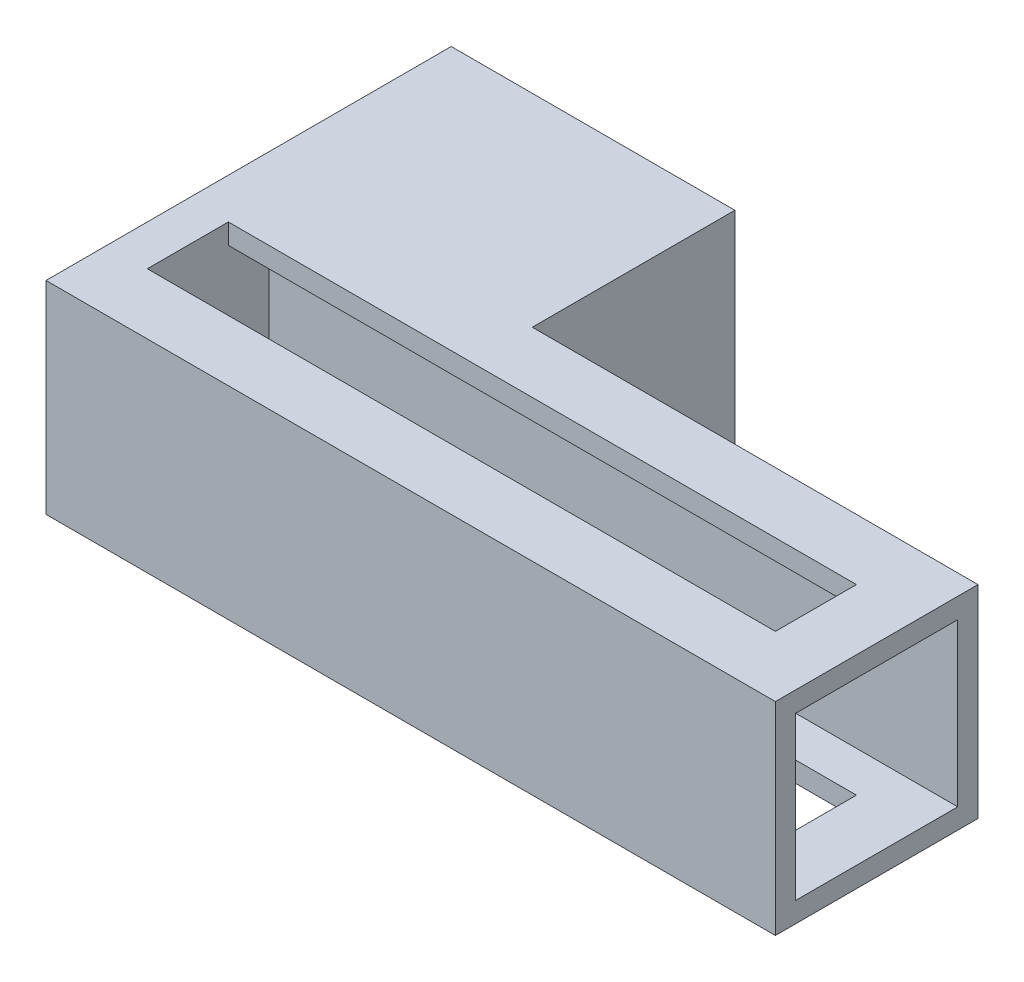
from build123d import *

# Parameters (mm, degrees)
CROQUIS1_W              = 70
CROQUIS1_H              = 50
SALIENTE_EXTRUIR1_DEPTH = 50
CROQUIS2_W              = 50
CROQUIS2_H              = 50
SALIENTE_EXTRUIR2_DEPTH = 180
CROQUIS3_W              = 40
CROQUIS3_H              = 40
CORTAR_EXTRUIR1_DEPTH   = 170
CORTAR_EXTRUIR2_DEPTH   = 50


with BuildPart() as part:
    # Croquis1 → Saliente-Extruir1 (new body)
    with BuildSketch(Plane.XY):
        Rectangle(CROQUIS1_W, CROQUIS1_H)
    extrude(amount=SALIENTE_EXTRUIR1_DEPTH)

    # Croquis2 → Saliente-Extruir2 (add)
    with BuildSketch(Plane.ZY.offset(35)):
        with Locations((75, 0)):
            Rectangle(CROQUIS2_W, CROQUIS2_H)
    extrude(amount=-SALIENTE_EXTRUIR2_DEPTH)

    # Croquis3 → Cortar-Extruir1 (cut)
    with BuildSketch(Plane(origin=(145, 0, 0), x_dir=(0, 0, -1), z_dir=(1, 0, 0))):
        with Locations((-75, 0)):
            Rectangle(CROQUIS3_W, CROQUIS3_H)
    extrude(amount=-CORTAR_EXTRUIR1_DEPTH, mode=Mode.SUBTRACT)

    # Croquis4 → Cortar-Extruir2 (cut)
    with BuildSketch(Plane.XZ.offset(25)):
        Polygon((60, 85), (-25, 85), (-25, 65), (60, 65), (130, 65), (130, 85), align=None)
    extrude(amount=-CORTAR_EXTRUIR2_DEPTH, mode=Mode.SUBTRACT)


solid = part.part
